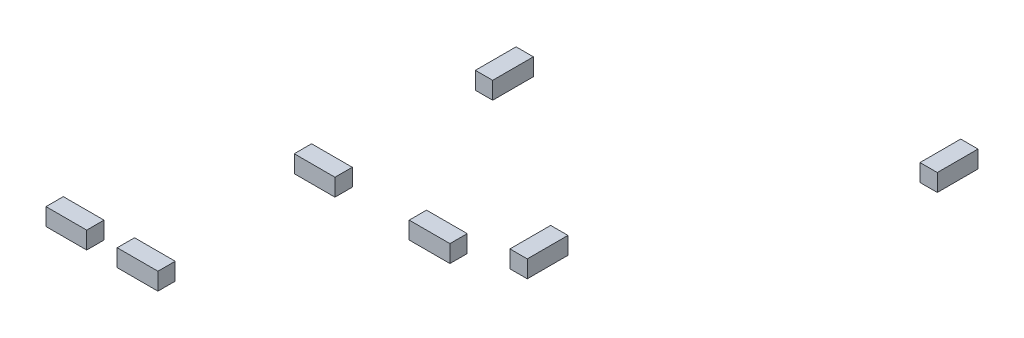
from build123d import *

# Parameters (mm, degrees)
SKETCH1_W             = 1.016
SKETCH1_H             = 0.4318
BOSS_EXTRUDE1_DEPTH   = 0.4318
SKETCH1_W_2           = 0.4318
SKETCH1_H_2           = 1.016
BOSS_EXTRUDE1_2_DEPTH = 0.4318
BOSS_EXTRUDE1_3_DEPTH = 0.4318
BOSS_EXTRUDE1_4_DEPTH = 0.4318
BOSS_EXTRUDE1_5_DEPTH = 0.4318
BOSS_EXTRUDE1_6_DEPTH = 0.4318
BOSS_EXTRUDE1_7_DEPTH = 0.4318


with BuildPart() as part:
    # Sketch1 → Boss-Extrude1 (new body)
    with BuildSketch(Plane(origin=(0, 0, 0), x_dir=(1, 0, 0), z_dir=(0, 1, 0))):
        with Locations((-0.635, 6.1341)):
            Rectangle(SKETCH1_W, SKETCH1_H)
    extrude(amount=BOSS_EXTRUDE1_DEPTH)


with BuildPart() as body_2:
    # Sketch1 → Boss-Extrude1 2 (new body)
    with BuildSketch(Plane(origin=(0, 0, 0), x_dir=(1, 0, 0), z_dir=(0, 1, 0))):
        with Locations((-0.2921, 14.732)):
            Rectangle(SKETCH1_W_2, SKETCH1_H_2)
    extrude(amount=BOSS_EXTRUDE1_2_DEPTH)


with BuildPart() as body_3:
    # Sketch1 → Boss-Extrude1 3 (new body)
    with BuildSketch(Plane(origin=(0, 0, 0), x_dir=(1, 0, 0), z_dir=(0, 1, 0))):
        with Locations((7.2517, 18.288)):
            Rectangle(SKETCH1_W_2, SKETCH1_H_2)
    extrude(amount=BOSS_EXTRUDE1_3_DEPTH)


with BuildPart() as body_4:
    # Sketch1 → Boss-Extrude1 4 (new body)
    with BuildSketch(Plane(origin=(0, 0, 0), x_dir=(1, 0, 0), z_dir=(0, 1, 0))):
        with Locations((-2.413, 6.1341)):
            Rectangle(SKETCH1_W, SKETCH1_H)
    extrude(amount=BOSS_EXTRUDE1_4_DEPTH)


with BuildPart() as body_5:
    # Sketch1 → Boss-Extrude1 5 (new body)
    with BuildSketch(Plane(origin=(0, 0, 0), x_dir=(1, 0, 0), z_dir=(0, 1, 0))):
        with Locations((-0.4572, 10.3759)):
            Rectangle(SKETCH1_W, SKETCH1_H)
    extrude(amount=BOSS_EXTRUDE1_5_DEPTH)


with BuildPart() as body_6:
    # Sketch1 → Boss-Extrude1 6 (new body)
    with BuildSketch(Plane(origin=(0, 0, 0), x_dir=(1, 0, 0), z_dir=(0, 1, 0))):
        with Locations((2.413, 10.3759)):
            Rectangle(SKETCH1_W, SKETCH1_H)
    extrude(amount=BOSS_EXTRUDE1_6_DEPTH)


with BuildPart() as body_7:
    # Sketch1 → Boss-Extrude1 7 (new body)
    with BuildSketch(Plane(origin=(0, 0, 0), x_dir=(1, 0, 0), z_dir=(0, 1, 0))):
        with Locations((4.0005, 11.303)):
            Rectangle(SKETCH1_W_2, SKETCH1_H_2)
    extrude(amount=BOSS_EXTRUDE1_7_DEPTH)


solid = Compound([part.part, body_2.part, body_3.part, body_4.part, body_5.part, body_6.part, body_7.part])
